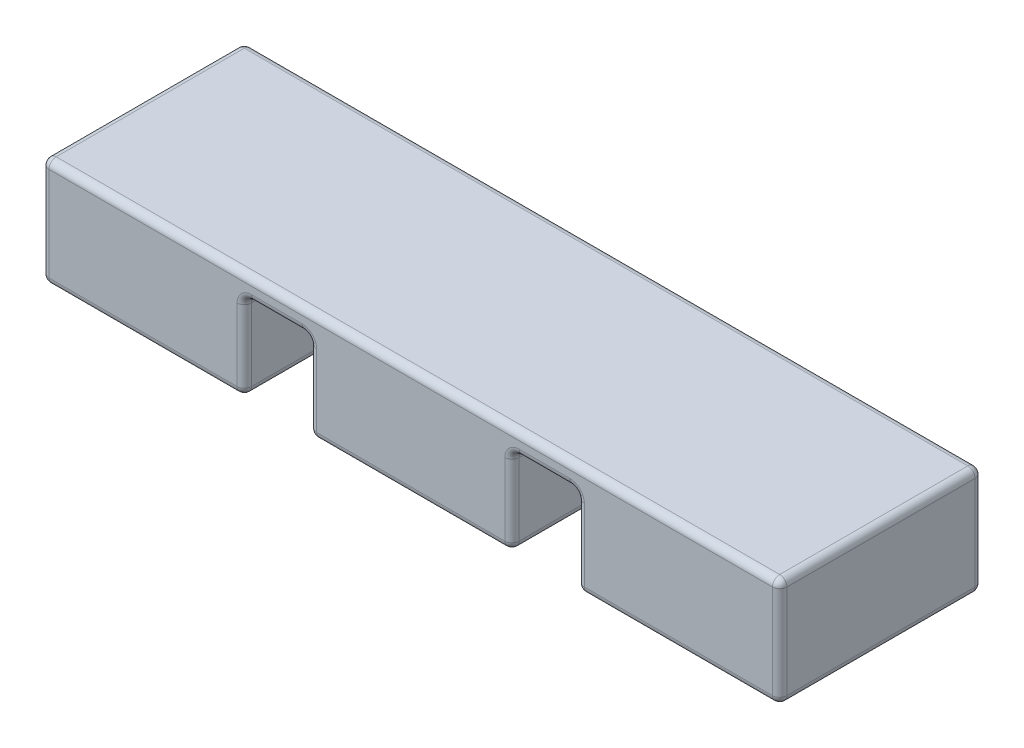
from build123d import *

# Parameters (mm, degrees)
SKETCH_2_W        = 28
SKETCH_2_H        = 28
EXTRUDE_3_DEPTH   = 12
EXTRUDE_3_2_DEPTH = 12
EXTRUDE_3_3_DEPTH = 12
SKETCH_2_3_W      = 9
SKETCH_2_3_H      = 28
SKETCH_2_3_W_2    = 28
EXTRUDE_4_DEPTH   = 3
FILLET_1_R        = 1


with BuildPart() as part:
    # 草图2 → 凸台-拉伸3 (new body)
    with BuildSketch(Plane(origin=(0, 0, 0), x_dir=(1, 0, 0), z_dir=(0, 1, 0))):
        with Locations((-37, 0)):
            Rectangle(SKETCH_2_W, SKETCH_2_H)
    extrude(amount=-EXTRUDE_3_DEPTH)



with BuildPart() as body_2:
    # 草图2 → Extrude 3 2 (new body)
    with BuildSketch(Plane(origin=(0, 0, 0), x_dir=(1, 0, 0), z_dir=(0, 1, 0))):
        Rectangle(SKETCH_2_W, SKETCH_2_H)
    extrude(amount=-EXTRUDE_3_2_DEPTH)


with BuildPart() as body_3:
    # 草图2 → Extrude 3 3 (new body)
    with BuildSketch(Plane(origin=(0, 0, 0), x_dir=(1, 0, 0), z_dir=(0, 1, 0))):
        with Locations((37, 0)):
            Rectangle(SKETCH_2_W, SKETCH_2_H)
    extrude(amount=-EXTRUDE_3_3_DEPTH)


with BuildPart() as part_1:
    add(part.part)

    add(body_2.part)  # 凸台-拉伸4 merges body 2

    add(body_3.part)  # 凸台-拉伸4 merges body 3
    # 草图2<3> → 凸台-拉伸4 (add)
    with BuildSketch(Plane(origin=(0, 0, 0), x_dir=(1, 0, 0), z_dir=(0, 1, 0))):
        with Locations((-18.5, 0)):
            Rectangle(SKETCH_2_3_W, SKETCH_2_3_H)
        with Locations((-37, 0)):
            Rectangle(SKETCH_2_3_W_2, SKETCH_2_3_H)
        Rectangle(SKETCH_2_3_W_2, SKETCH_2_3_H)
        with Locations((18.5, 0)):
            Rectangle(SKETCH_2_3_W, SKETCH_2_3_H)
        with Locations((37, 0)):
            Rectangle(SKETCH_2_3_W_2, SKETCH_2_3_H)
    extrude(amount=EXTRUDE_4_DEPTH)

    # 圆角1
    fillet_1_edges = [part_1.edges().sort_by_distance(p)[0] for p in [
        (-37, -12, -14),
        (-51, -12, 0),
        (0, 3, -14),
        (51, -4.5, -14),
        (-18.5, 0, 14),
        (51, 3, 0),
        (51, -4.5, 14),
        (-51, 3, 0),
        (0, 3, 14),
        (-18.5, 0, -14),
        (-37, -12, 14),
        (18.5, 0, -14),
        (18.5, 0, 14),
        (14, 0, 0),
        (14, -6, -14),
        (0, -12, 14),
        (14, -6, 14),
        (-14, -12, 0),
        (-14, -6, 14),
        (-14, -6, -14),
        (14, -12, 0),
        (0, -12, -14),
        (-14, 0, 0),
        (37, -12, 14),
        (23, -12, 0),
        (23, -6, 14),
        (23, -6, -14),
        (51, -12, 0),
        (37, -12, -14),
        (23, 0, 0),
        (-23, -12, 0),
        (-23, 0, 0),
        (-23, -6, 14),
        (-51, -4.5, 14),
        (-51, -4.5, -14),
        (-23, -6, -14),
    ]]
    fillet(fillet_1_edges, radius=FILLET_1_R)


solid = part_1.part
